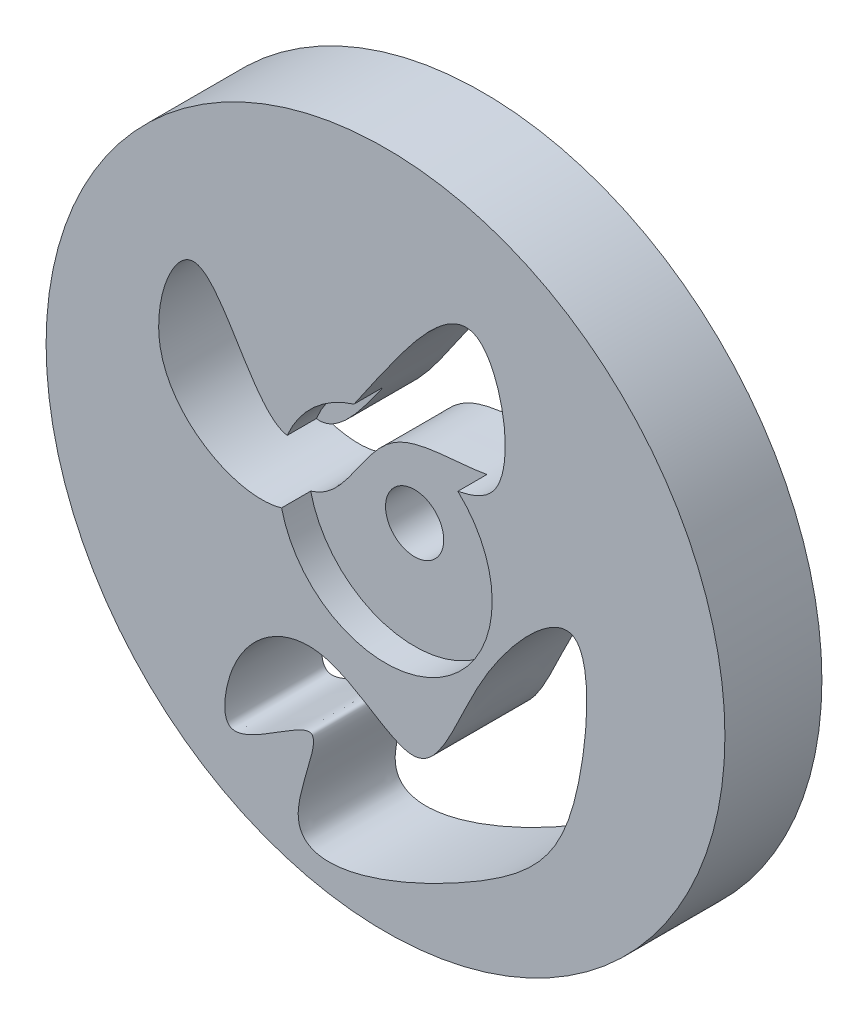
from build123d import *

# Parameters (mm, degrees)
SKETCH1_R           = 35
SKETCH1_R_2         = 3
BOSS_EXTRUDE1_DEPTH = 10
SKETCH2_R           = 11
CUT_EXTRUDE1_DEPTH  = 3


with BuildPart() as part:
    # Sketch1 → Boss-Extrude1 (new body)
    with BuildSketch(Plane.XY):
        with Locations((19.925, -7)):
            Circle(SKETCH1_R)
        with Locations((19.925, -7)):
            Circle(SKETCH1_R_2, mode=Mode.SUBTRACT)
        with BuildLine():
            add(Edge.make_bspline(
                [(-3.303784625, -1.411376682), (-4.060622428, 2.629528267), (0.792352576, 15.140689089), (8.107163628, -8.164318494), (18.684149963, 5.919172239), (30.004295906, 24.147981216), (34.893137342, -1.932691801), (16.263676947, 3.104859356), (11.594097844, -14.033466189), (-2.127374663, -7.692459391), (-3.303784625, -1.411376682)],
                knots=[0, 0, 0, 0, 0.094982803, 0.231024987, 0.320786961, 0.491003828, 0.611450076, 0.741130175, 0.85236108, 1, 1, 1, 1], degree=3))
        make_face(mode=Mode.SUBTRACT)
        with BuildLine():
            add(Edge.make_bspline(
                [(3.843463707, -27.246384416), (5.335668106, -22.520042145), (13.015883006, -17.275135878), (24.626923004, -29.226312083), (28.46721661, -14.013010297), (41.724481509, -0.209082999), (40.256668905, -23.316889409), (33.095262083, -32.360986488), (5.806418145, -43.99516773), (15.830491207, -23.154093358), (2.687621606, -35.329362756), (3.282110085, -29.024391071), (3.843463707, -27.246384416)],
                knots=[0, 0, 0, 0, 0.099425136, 0.186607091, 0.296094071, 0.401579901, 0.513343115, 0.662290541, 0.819329866, 0.88504245, 0.962597175, 1, 1, 1, 1], degree=3))
        make_face(mode=Mode.SUBTRACT)
    extrude(amount=BOSS_EXTRUDE1_DEPTH)

    # Sketch2 → Cut-Extrude1 (cut)
    with BuildSketch(Plane.XY.offset(10)):
        with Locations((19.925, -7)):
            Circle(SKETCH2_R)
    extrude(amount=-CUT_EXTRUDE1_DEPTH, mode=Mode.SUBTRACT)


solid = part.part
